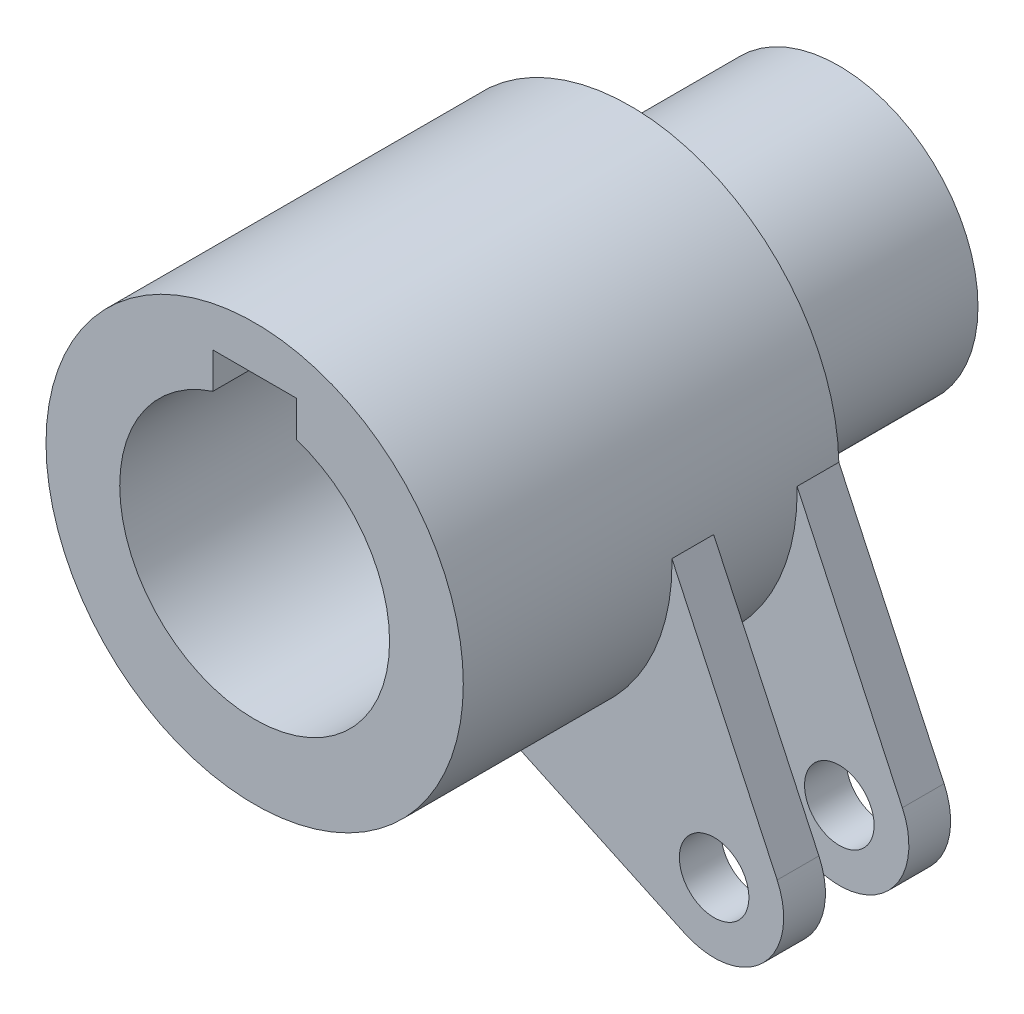
from build123d import *

# Parameters (mm, degrees)
BOSS_EXTRUDE4_DEPTH = 12
SKETCH3_4_R         = 5
SKETCH3_4_R_2       = 2.5
BOSS_EXTRUDE5_DEPTH = 3
BOSS_EXTRUDE6_START = -9
SKETCH3_5_R         = 5
SKETCH3_5_R_2       = 2.5
BOSS_EXTRUDE6_DEPTH = 3
BOSS_EXTRUDE7_START = -12
SKETCH2_R           = 10
BOSS_EXTRUDE7_DEPTH = 15
BOSS_EXTRUDE8_START = 15
SKETCH5_R           = 15
BOSS_EXTRUDE8_DEPTH = 15


with BuildPart() as part:
    # Sketch3 → Boss-Extrude4 (new body)
    with BuildSketch(Plane.XY):
        with BuildLine():
            ThreePointArc((15, 0), (14.999214481, 0.153508816), (14.996858006, 0.307001554))
            ThreePointArc((14.996858006, 0.307001554), (-10.606601718, 10.606601718), (-0.307001554, -14.996858006))
            ThreePointArc((-0.307001554, -14.996858006), (10.497499147, -10.714593397), (15, 0))
        make_face()
        with BuildLine():
            ThreePointArc((4.1, 0), (-2.074849392, -3.536240942), (-2, 3.579106034))
            Line((-2, 3.579106034), (-2, 5.1))
            Line((-2, 5.1), (2, 5.1))
            Line((2, 5.1), (2, 3.579106034))
            ThreePointArc((2, 3.579106034), (3.536240942, 2.074849392), (4.1, 0))
        make_face(mode=Mode.SUBTRACT)
    extrude(amount=-BOSS_EXTRUDE4_DEPTH)

    # Sketch3<4> → Boss-Extrude5 (add)
    # profile 1 of 2: a face of its own
    with BuildSketch(Plane.XY):
        with BuildLine():
            ThreePointArc((15.918131612, -22.562761855), (14.495689014, -14.495689014), (22.562761855, -15.918131612))
            Line((22.562761855, -15.918131612), (14.996858006, 0.307001554))
            ThreePointArc((14.996858006, 0.307001554), (14.999214481, 0.153508816), (15, 0))
            ThreePointArc((15, 0), (10.497499147, -10.714593397), (-0.307001554, -14.996858006))
            Line((-0.307001554, -14.996858006), (15.918131612, -22.562761855))
        make_face()
    # profile 2 of 2: a face of its own
    with BuildSketch(Plane.XY):
        with Locations((18.03122292, -18.03122292)):
            Circle(SKETCH3_4_R)
        with Locations((18.03122292, -18.03122292)):
            Circle(SKETCH3_4_R_2, mode=Mode.SUBTRACT)
    extrude(amount=-BOSS_EXTRUDE5_DEPTH)

    # Sketch3<5> → Boss-Extrude6 (add)
    # profile 1 of 2: a face of its own
    with BuildSketch(Plane.XY.offset(BOSS_EXTRUDE6_START)):
        with BuildLine():
            ThreePointArc((15.918131612, -22.562761855), (14.495689014, -14.495689014), (22.562761855, -15.918131612))
            Line((22.562761855, -15.918131612), (14.996858006, 0.307001554))
            ThreePointArc((14.996858006, 0.307001554), (14.999214481, 0.153508816), (15, 0))
            ThreePointArc((15, 0), (10.497499147, -10.714593397), (-0.307001554, -14.996858006))
            Line((-0.307001554, -14.996858006), (15.918131612, -22.562761855))
        make_face()
    # profile 2 of 2: a face of its own
    with BuildSketch(Plane.XY.offset(BOSS_EXTRUDE6_START)):
        with Locations((18.03122292, -18.03122292)):
            Circle(SKETCH3_5_R)
        with Locations((18.03122292, -18.03122292)):
            Circle(SKETCH3_5_R_2, mode=Mode.SUBTRACT)
    extrude(amount=-BOSS_EXTRUDE6_DEPTH)

    # Sketch2 → Boss-Extrude7 (add)
    with BuildSketch(Plane.XY.offset(BOSS_EXTRUDE7_START)):
        Circle(SKETCH2_R)
        with BuildLine():
            ThreePointArc((4.1, 0), (-2.074849392, -3.536240942), (-2, 3.579106034))
            Line((-2, 3.579106034), (-2, 5.1))
            Line((-2, 5.1), (2, 5.1))
            Line((2, 5.1), (2, 3.579106034))
            ThreePointArc((2, 3.579106034), (3.536240942, 2.074849392), (4.1, 0))
        make_face(mode=Mode.SUBTRACT)
    extrude(amount=-BOSS_EXTRUDE7_DEPTH)

    # Sketch5 → Boss-Extrude8 (add)
    with BuildSketch(Plane.XY.offset(BOSS_EXTRUDE8_START)):
        Circle(SKETCH5_R)
        with BuildLine():
            Line((-3, 9.224424101), (-3, 11.8))
            Line((-3, 11.8), (3, 11.8))
            Line((3, 11.8), (3, 9.224424101))
            ThreePointArc((3, 9.224424101), (7.848248212, 5.70043858), (9.7, 0))
            ThreePointArc((9.7, 0), (-5.70043858, -7.848248212), (-3, 9.224424101))
        make_face(mode=Mode.SUBTRACT)
    extrude(amount=-BOSS_EXTRUDE8_DEPTH)


solid = part.part
